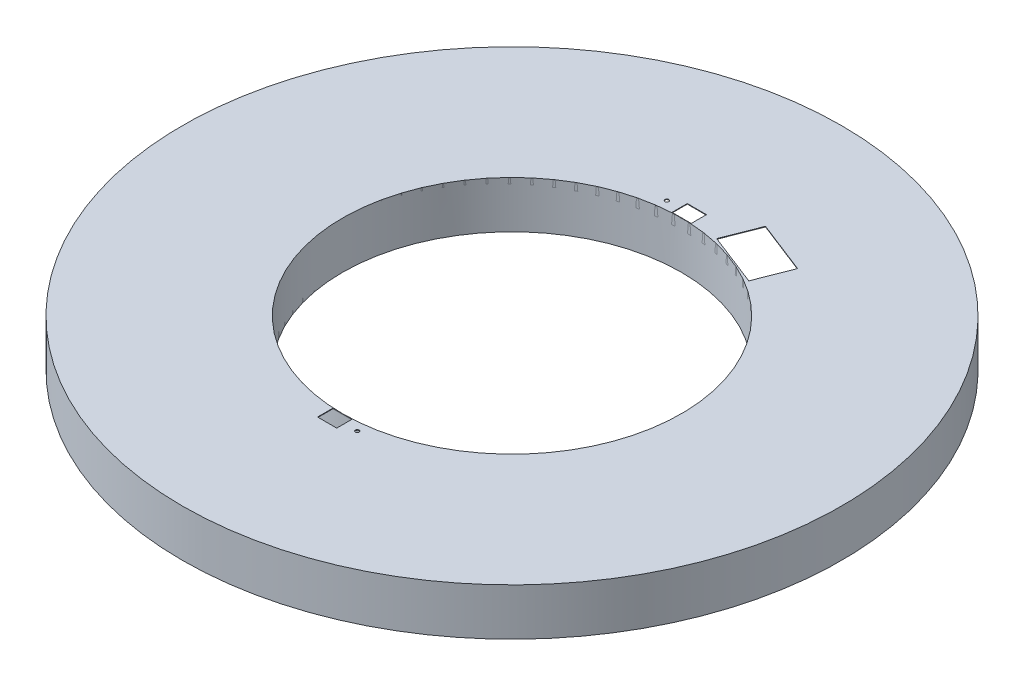
from build123d import *

# Parameters (mm, degrees)
SKETCH1_R               = 1750
BOSS_EXTRUDE1_DEPTH     = 500
SKETCH2_R               = 900
CUT_EXTRUDE2_DEPTH      = 300
SKETCH3_R               = 600
CUT_EXTRUDE3_DEPTH      = 300
SKETCH4_R               = 1748.5
SKETCH4_R_2             = 900.75
CUT_EXTRUDE5_DEPTH      = 497
CUT_EXTRUDE6_DEPTH      = 2525.876234591
CUT_EXTRUDE6_DEPTH_BACK = 2525.876234591
SKETCH5_W               = 1750
SKETCH5_H               = 250
CUT_EXTRUDE7_DEPTH      = 10
CIRPATTERN1_COUNT       = 2
SKETCH7_R               = 10
CUT_EXTRUDE8_DEPTH      = 10
CUT_EXTRUDE9_DEPTH      = 10


with BuildPart() as part:
    # Sketch1 → Boss-Extrude1 (new body)
    with BuildSketch(Plane(origin=(0, 0, 0), x_dir=(1, 0, 0), z_dir=(0, 1, 0))):
        with Locations(Location((0, 0, 0), (0, 0, 270))):
            Circle(SKETCH1_R)
    extrude(amount=BOSS_EXTRUDE1_DEPTH)

    # Sketch2 → Cut-Extrude2 (cut)
    with BuildSketch(Plane(origin=(0, 500, 0), x_dir=(1, 0, 0), z_dir=(0, 1, 0))):
        with Locations(Location((0, 0, 0), (0, 0, 270))):
            Circle(SKETCH2_R)
    extrude(amount=-CUT_EXTRUDE2_DEPTH, mode=Mode.SUBTRACT)

    # Sketch3 → Cut-Extrude3 (cut)
    with BuildSketch(Plane.XZ):
        with Locations(Location((0, 0, 0), (0, 0, 270))):
            Circle(SKETCH3_R)
    extrude(amount=-CUT_EXTRUDE3_DEPTH, mode=Mode.SUBTRACT)

    # Sketch4 → Cut-Extrude5 (cut)
    with BuildSketch(Plane(origin=(0, 0, 0), x_dir=(-1, 0, 0), z_dir=(0, -1, 0))):
        with Locations(Location((0, 0, 0), (0, 0, 90))):
            Circle(SKETCH4_R)
        with Locations(Location((0, 0, 0), (0, 0, 90))):
            Circle(SKETCH4_R_2, mode=Mode.SUBTRACT)
    extrude(amount=-CUT_EXTRUDE5_DEPTH, mode=Mode.SUBTRACT)

    # Sketch5 → Cut-Extrude6 (cut, two sides: drawn at the far end of the back side and taken through both)
    with BuildSketch(Plane.XY.offset(-CUT_EXTRUDE6_DEPTH_BACK)):
        with Locations((-875, 125)):
            Rectangle(SKETCH5_W, SKETCH5_H)
        with Locations((875, 125)):
            Rectangle(SKETCH5_W, SKETCH5_H)
    extrude(amount=CUT_EXTRUDE6_DEPTH + CUT_EXTRUDE6_DEPTH_BACK, mode=Mode.SUBTRACT)

    # Sketch6 → Cut-Extrude7 (cut)
    with BuildSketch(Plane.XZ.offset(-497)):
        Polygon((0, 900.75), (51, 900.75), (51, 981.75), (-51, 981.75), (-51, 900.75), align=None)
    cut_extrude7 = extrude(amount=-CUT_EXTRUDE7_DEPTH, mode=Mode.SUBTRACT)

    # CirPattern1: Cut-Extrude7 ×2 about axis
    cirpattern1_axis = Axis((0, 0, 0), (0, 1, 0))
    for i in range(1, CIRPATTERN1_COUNT):
        add(cut_extrude7.rotate(cirpattern1_axis, i * 360 / CIRPATTERN1_COUNT), mode=Mode.SUBTRACT)

    # Sketch7 → Cut-Extrude8 (cut)
    with BuildSketch(Plane.XZ.offset(-497)):
        with Locations(Location((-118.818630958, -941.25, 0), (0, 0, 270))):
            Circle(SKETCH7_R)
        with Locations(Location((119.300731455, 941.189016636, 0), (0, 0, 270))):
            Circle(SKETCH7_R)
    extrude(amount=-CUT_EXTRUDE8_DEPTH, mode=Mode.SUBTRACT)

    # Sketch8 → Cut-Extrude9 (cut)
    with BuildSketch(Plane.XZ.offset(-497)):
        Polygon((188.594951024, -898.445391682), (468.046247167, -789.326314141), (540.792298862, -975.627178236), (261.341002718, -1084.746255778), align=None)
    extrude(amount=-CUT_EXTRUDE9_DEPTH, mode=Mode.SUBTRACT)


solid = part.part
